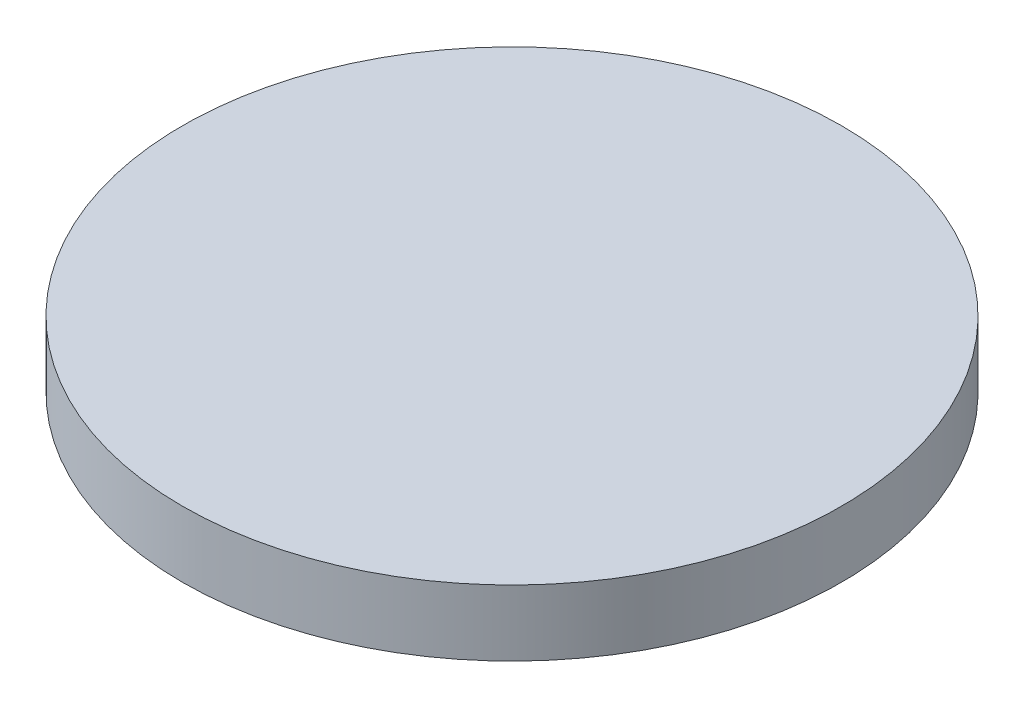
from build123d import *

# Parameters (mm, degrees)
SKETCH2_W = 31.75
SKETCH2_H = 6.35


with BuildPart() as part:
    # Sketch2 → Revolve1 (revolve)
    with BuildSketch(Plane.XY, mode=Mode.PRIVATE) as revolve1_sk:
        with Locations((-15.875, 0)):
            Rectangle(SKETCH2_W, SKETCH2_H)
    revolve(revolve1_sk.sketch.rotate(Axis((0, 3.175, 0), (0, -1, 0)), 270), axis=Axis((0, 3.175, 0), (0, -1, 0)))


solid = part.part
